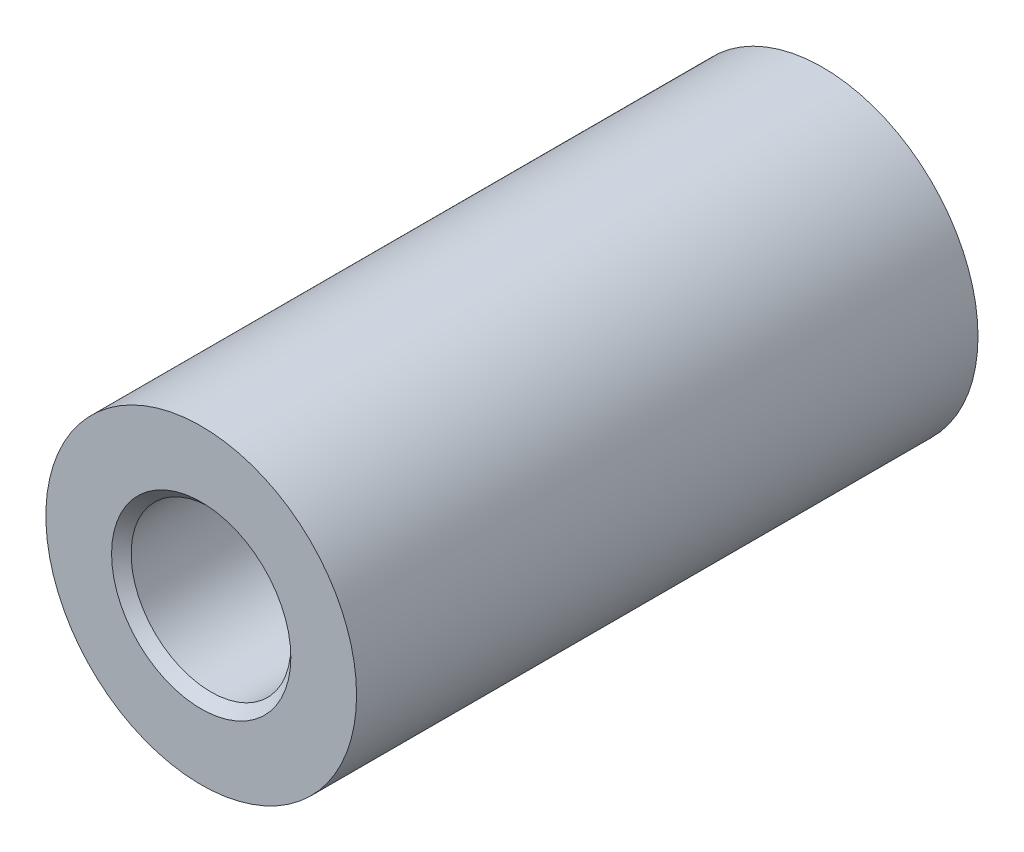
from build123d import *

# Parameters (mm, degrees)
SKETCH1_R                = 6.35
BOSS_EXTRUDE1_DEPTH      = 25.4
F_0_257_DIAMETER_HOLE1_D = 6.5278
CHAMFER1_SIZE            = 0.4


with BuildPart() as part:
    # Sketch1 → Boss-Extrude1 (new body)
    with BuildSketch(Plane.XY):
        Circle(SKETCH1_R)
    extrude(amount=BOSS_EXTRUDE1_DEPTH)

    # F (0.257) Diameter Hole1 (through all)
    with Locations(Plane.XY.offset(25.4)):
        with Locations((0, 0)):
            Hole(F_0_257_DIAMETER_HOLE1_D / 2)

    # Chamfer1
    chamfer1_edges = [part.edges().sort_by_distance(p)[0] for p in [
        (3.2639, 0, 25.4),
        (3.2639, 0, 0),
    ]]
    chamfer(chamfer1_edges, length=CHAMFER1_SIZE)


solid = part.part
